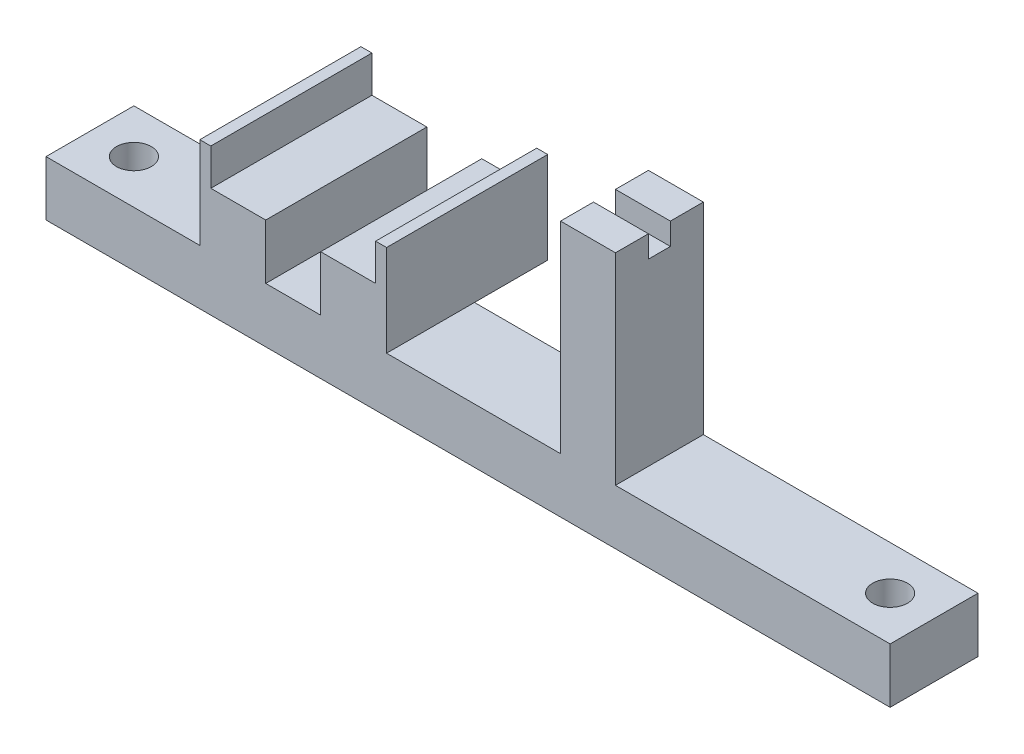
from build123d import *

# Parameters (mm, degrees)
SKETCH1_W           = 230.5
SKETCH1_H           = 24
BOSS_EXTRUDE1_DEPTH = 15
SKETCH2_R           = 4.75
CUT_EXTRUDE1_DEPTH  = 15
SKETCH4_W           = 18
SKETCH4_H           = 44
BOSS_EXTRUDE2_DEPTH = 15
SKETCH5_W           = 15
SKETCH5_H           = 24
BOSS_EXTRUDE3_DEPTH = 49
SKETCH6_W           = 15
SKETCH6_H           = 9
BOSS_EXTRUDE4_DEPTH = 6
SKETCH7_W           = 3
SKETCH7_H           = 44
BOSS_EXTRUDE5_DEPTH = 10


with BuildPart() as part:
    # Sketch1 → Boss-Extrude1 (new body)
    with BuildSketch(Plane(origin=(0, 0, 0), x_dir=(1, 0, 0), z_dir=(0, 1, 0))):
        with Locations((21.518565941, 35.196222791)):
            Rectangle(SKETCH1_W, SKETCH1_H)
    extrude(amount=BOSS_EXTRUDE1_DEPTH)

    # Sketch2 → Cut-Extrude1 (cut)
    with BuildSketch(Plane(origin=(0, 15, 0), x_dir=(1, 0, 0), z_dir=(0, 1, 0))):
        with Locations(Location((-81.731434059, 35.196222791, 0), (0, 0, 270))):
            Circle(SKETCH2_R)
        with Locations(Location((124.768565941, 35.196222791, 0), (0, 0, 270))):
            Circle(SKETCH2_R)
    extrude(amount=-CUT_EXTRUDE1_DEPTH, mode=Mode.SUBTRACT)

    # Sketch4 → Boss-Extrude2 (add)
    with BuildSketch(Plane(origin=(0, 15, 0), x_dir=(1, 0, 0), z_dir=(0, 1, 0))):
        with Locations((-42.731434059, 45.196222791)):
            Rectangle(SKETCH4_W, SKETCH4_H)
        with Locations((-9.731434059, 45.196222791)):
            Rectangle(SKETCH4_W, SKETCH4_H)
    extrude(amount=BOSS_EXTRUDE2_DEPTH)

    # Sketch5 → Boss-Extrude3 (add)
    with BuildSketch(Plane(origin=(0, 15, 0), x_dir=(1, 0, 0), z_dir=(0, 1, 0))):
        with Locations((54.268565941, 35.196222791)):
            Rectangle(SKETCH5_W, SKETCH5_H)
    extrude(amount=BOSS_EXTRUDE3_DEPTH)

    # Sketch6 → Boss-Extrude4 (add)
    with BuildSketch(Plane(origin=(0, 64, 0), x_dir=(1, 0, 0), z_dir=(0, 1, 0))):
        with Locations((54.268565941, 42.696222791)):
            Rectangle(SKETCH6_W, SKETCH6_H)
        with Locations((54.268565941, 27.696222791)):
            Rectangle(SKETCH6_W, SKETCH6_H)
    extrude(amount=BOSS_EXTRUDE4_DEPTH)

    # Sketch7 → Boss-Extrude5 (add)
    with BuildSketch(Plane(origin=(0, 30, 0), x_dir=(1, 0, 0), z_dir=(0, 1, 0))):
        with Locations((-50.231434059, 45.196222791)):
            Rectangle(SKETCH7_W, SKETCH7_H)
        with Locations((-2.231434059, 45.196222791)):
            Rectangle(SKETCH7_W, SKETCH7_H)
    extrude(amount=BOSS_EXTRUDE5_DEPTH)


solid = part.part
